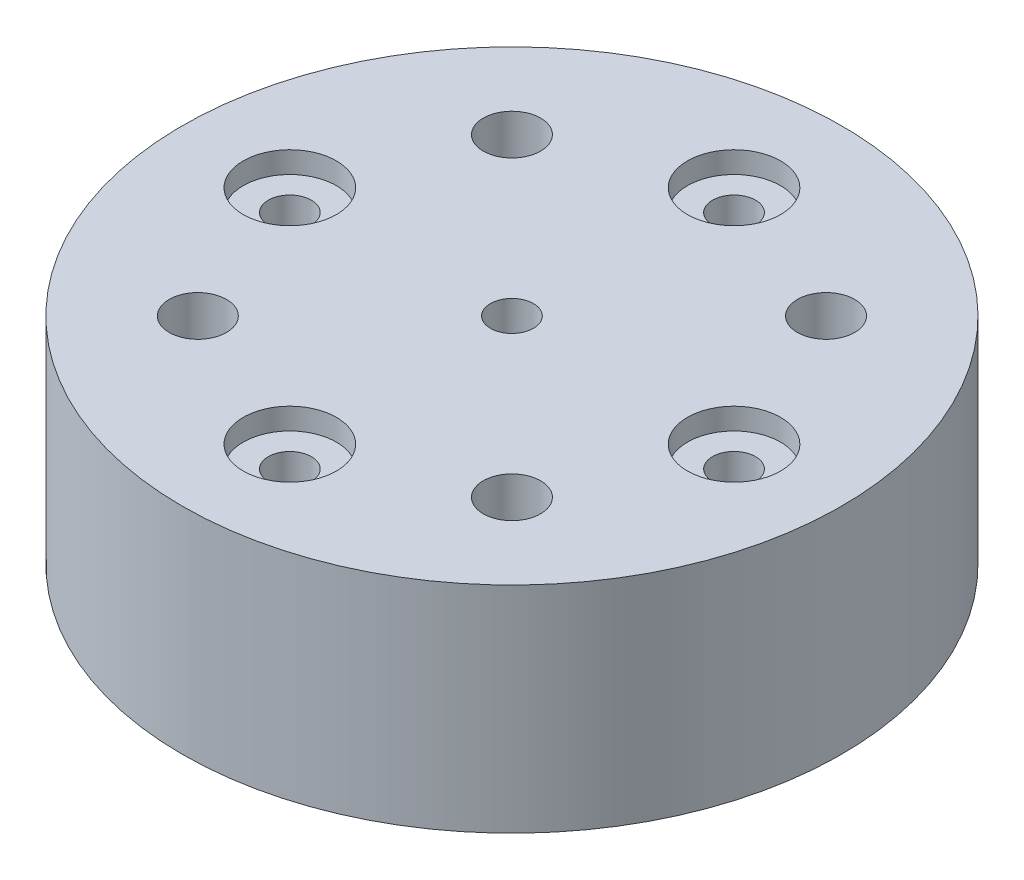
from build123d import *

# Parameters (mm, degrees)
SKETCH1_R           = 23
SKETCH1_R_2         = 1.5
BOSS_EXTRUDE1_DEPTH = 15
SKETCH2_R           = 3.25
CUT_EXTRUDE1_DEPTH  = 1.5
SKETCH3_R           = 2
CUT_EXTRUDE2_DEPTH  = 10


with BuildPart() as part:
    # Sketch1 → Boss-Extrude1 (new body)
    with BuildSketch(Plane(origin=(0, 0, 0), x_dir=(1, 0, 0), z_dir=(0, 1, 0))):
        with Locations(Location((0, 0, 0), (0, 0, 270))):
            Circle(SKETCH1_R)
        with Locations(Location((0, 15.5, 0), (0, 0, 270))):
            Circle(SKETCH1_R_2, mode=Mode.SUBTRACT)
        with Locations(Location((15.5, 0, 0), (0, 0, 270))):
            Circle(SKETCH1_R_2, mode=Mode.SUBTRACT)
        with Locations(Location((0, -15.5, 0), (0, 0, 270))):
            Circle(SKETCH1_R_2, mode=Mode.SUBTRACT)
        with Locations(Location((-15.5, 0, 0), (0, 0, 270))):
            Circle(SKETCH1_R_2, mode=Mode.SUBTRACT)
        with Locations(Location((0, 0, 0), (0, 0, 270))):
            Circle(SKETCH1_R_2, mode=Mode.SUBTRACT)
    extrude(amount=BOSS_EXTRUDE1_DEPTH)

    # Sketch2 → Cut-Extrude1 (cut)
    with BuildSketch(Plane(origin=(0, 15, 0), x_dir=(1, 0, 0), z_dir=(0, 1, 0))):
        with Locations(Location((0, 15.5, 0), (0, 0, 270))):
            Circle(SKETCH2_R)
        with Locations(Location((15.5, 0, 0), (0, 0, 270))):
            Circle(SKETCH2_R)
        with Locations(Location((0, -15.5, 0), (0, 0, 270))):
            Circle(SKETCH2_R)
        with Locations(Location((-15.5, 0, 0), (0, 0, 270))):
            Circle(SKETCH2_R)
    extrude(amount=-CUT_EXTRUDE1_DEPTH, mode=Mode.SUBTRACT)

    # Sketch3 → Cut-Extrude2 (cut)
    with BuildSketch(Plane(origin=(0, 15, 0), x_dir=(1, 0, 0), z_dir=(0, 1, 0))):
        with Locations(Location((-10.960155108, 10.960155108, 0), (0, 0, 270))):
            Circle(SKETCH3_R)
        with Locations(Location((10.960155108, 10.960155108, 0), (0, 0, 270))):
            Circle(SKETCH3_R)
        with Locations(Location((10.960155108, -10.960155108, 0), (0, 0, 270))):
            Circle(SKETCH3_R)
        with Locations(Location((-10.960155108, -10.960155108, 0), (0, 0, 270))):
            Circle(SKETCH3_R)
    extrude(amount=-CUT_EXTRUDE2_DEPTH, mode=Mode.SUBTRACT)


solid = part.part
